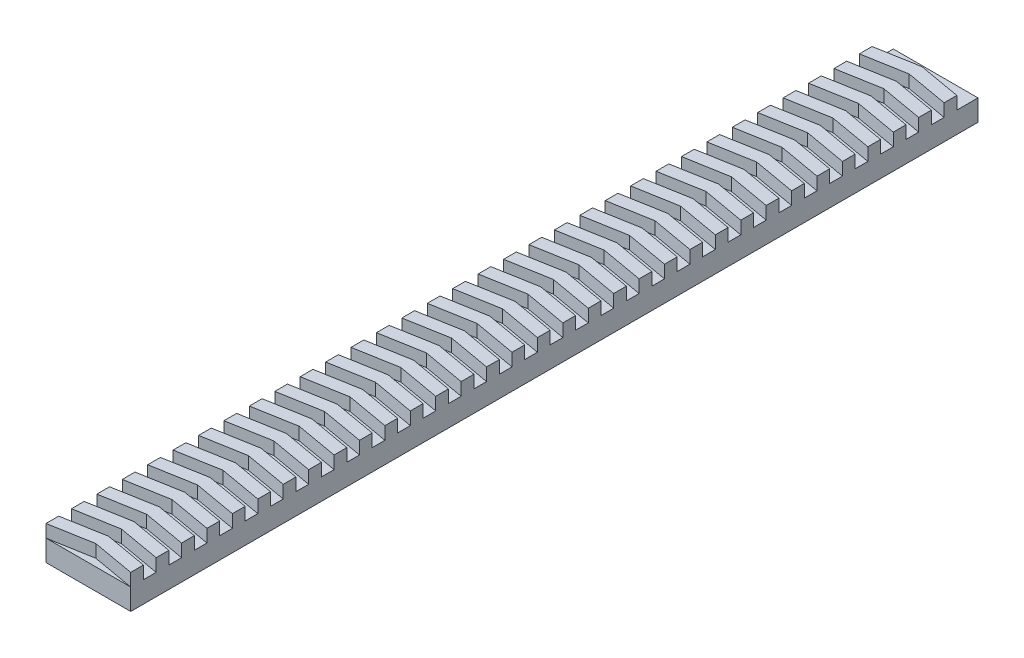
from build123d import *

# Parameters (mm, degrees)
SKETCH2_W           = 20
SKETCH2_H           = 200
BOSS_EXTRUDE1_DEPTH = 5
BOSS_EXTRUDE2_DEPTH = 3
LPATTERN1_COUNT     = 33
LPATTERN1_PITCH     = 6


with BuildPart() as part:
    # Sketch2 → Boss-Extrude1 (new body)
    with BuildSketch(Plane(origin=(0, 0, 0), x_dir=(1, 0, 0), z_dir=(0, 1, 0))):
        Rectangle(SKETCH2_W, SKETCH2_H)
    extrude(amount=BOSS_EXTRUDE1_DEPTH)

    # Sketch3 → Boss-Extrude2 (add)
    with BuildSketch(Plane(origin=(0, 5, 0), x_dir=(1, 0, 0), z_dir=(0, 1, 0))):
        Polygon((-10, -100), (0, -98.236730193), (10, -100), (10, -97), (0, -95.236730193), (-10, -97), align=None)
    boss_extrude2 = extrude(amount=BOSS_EXTRUDE2_DEPTH)

    # LPattern1: Boss-Extrude2 ×33
    with Locations(*[(0, 0, -i * LPATTERN1_PITCH) for i in range(1, LPATTERN1_COUNT)]):
        add(boss_extrude2)


solid = part.part
